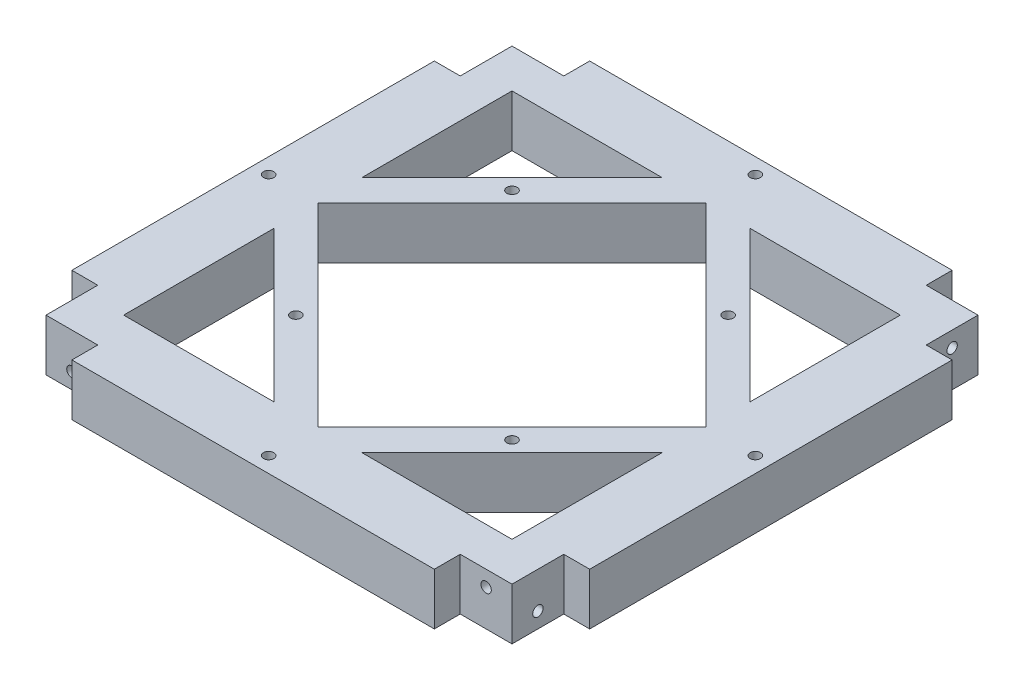
from build123d import *

# Parameters (mm, degrees)
SKETCH1_W           = 100
SKETCH1_H           = 100
BOSS_EXTRUDE1_DEPTH = 10
CUT_EXTRUDE1_DEPTH  = 72.414284285
SKETCH3_W           = 75
SKETCH3_H           = 75
CUT_EXTRUDE2_DEPTH  = 10
BOSS_EXTRUDE2_DEPTH = 10
SKETCH10_R          = 1
CUT_EXTRUDE7_DEPTH  = 72.414284285
SKETCH11_R          = 1
CUT_EXTRUDE8_DEPTH  = 72.414284285
SKETCH12_R          = 1
CUT_EXTRUDE9_DEPTH  = 72.414284285
SKETCH9_R           = 1
CUT_EXTRUDE11_DEPTH = 10
SKETCH13_R          = 1
CUT_EXTRUDE12_DEPTH = 10
SKETCH14_R          = 1
CUT_EXTRUDE13_DEPTH = 10
SKETCH15_R          = 1
CUT_EXTRUDE14_DEPTH = 10
SKETCH16_R          = 1
CUT_EXTRUDE15_DEPTH = 10
SKETCH17_R          = 1
CUT_EXTRUDE16_DEPTH = 10
SKETCH18_R          = 1
CUT_EXTRUDE17_DEPTH = 10
SKETCH19_R          = 1
CUT_EXTRUDE18_DEPTH = 10


with BuildPart() as part:
    # Sketch1 → Boss-Extrude1 (new body)
    with BuildSketch(Plane(origin=(0, 0, 0), x_dir=(1, 0, 0), z_dir=(0, 1, 0))):
        Rectangle(SKETCH1_W, SKETCH1_H)
    extrude(amount=BOSS_EXTRUDE1_DEPTH)

    # Sketch2 → Cut-Extrude1 (cut, through all)
    with BuildSketch(Plane(origin=(0, 10, 0), x_dir=(1, 0, 0), z_dir=(0, 1, 0))):
        Polygon((35, 50), (35, 45), (45, 45), (45, 35), (50, 35), (50, 50), align=None)
        Polygon((-45, 35), (-50, 35), (-50, 50), (-35, 50), (-35, 45), (-45, 45), align=None)
        Polygon((-45, -35), (-50, -35), (-50, -50), (-35, -50), (-35, -45), (-45, -45), align=None)
        Polygon((35, -50), (35, -45), (45, -45), (45, -35), (50, -35), (50, -50), align=None)
    extrude(amount=-CUT_EXTRUDE1_DEPTH, mode=Mode.SUBTRACT)

    # Sketch3 → Cut-Extrude2 (cut)
    with BuildSketch(Plane(origin=(0, 10, 0), x_dir=(1, 0, 0), z_dir=(0, 1, 0))):
        Rectangle(SKETCH3_W, SKETCH3_H)
    extrude(amount=-CUT_EXTRUDE2_DEPTH, mode=Mode.SUBTRACT)

    # Sketch4 → Boss-Extrude2 (add)
    with BuildSketch(Plane(origin=(0, 10, 0), x_dir=(1, 0, 0), z_dir=(0, 1, 0))):
        Polygon((45.985281374, 0), (0, 45.985281374), (-45.985281374, 0), (0, -45.985281374), align=None)
        Polygon((0, 37.5), (-37.5, 0), (0, -37.5), (37.5, 0), align=None, mode=Mode.SUBTRACT)
    extrude(amount=-BOSS_EXTRUDE2_DEPTH)

    # Sketch10 → Cut-Extrude7 (cut, through all)
    with BuildSketch(Plane(origin=(0, 10, 0), x_dir=(1, 0, 0), z_dir=(0, 1, 0))):
        with Locations(Location((0, 47, 0), (0, 0, 270))):
            Circle(SKETCH10_R)
        with Locations(Location((0, -47, 0), (0, 0, 90))):
            Circle(SKETCH10_R)
    extrude(amount=-CUT_EXTRUDE7_DEPTH, mode=Mode.SUBTRACT)

    # Sketch11 → Cut-Extrude8 (cut, through all)
    with BuildSketch(Plane(origin=(0, 10, 0), x_dir=(1, 0, 0), z_dir=(0, 1, 0))):
        with Locations(Location((-47, 0, 0), (0, 0, 270))):
            Circle(SKETCH11_R)
        with Locations(Location((47, 0, 0), (0, 0, 90))):
            Circle(SKETCH11_R)
    extrude(amount=-CUT_EXTRUDE8_DEPTH, mode=Mode.SUBTRACT)

    # Sketch12 → Cut-Extrude9 (cut, through all)
    with BuildSketch(Plane(origin=(0, 10, 0), x_dir=(1, 0, 0), z_dir=(0, 1, 0))):
        with Locations(Location((-20.871320344, 20.871320344, 0), (0, 0, 270))):
            Circle(SKETCH12_R)
        with Locations(Location((20.871320344, 20.871320344, 0), (0, 0, 90))):
            Circle(SKETCH12_R)
        with Locations(Location((20.871320344, -20.871320344, 0), (0, 0, 270))):
            Circle(SKETCH12_R)
        with Locations(Location((-20.871320344, -20.871320344, 0), (0, 0, 90))):
            Circle(SKETCH12_R)
    extrude(amount=-CUT_EXTRUDE9_DEPTH, mode=Mode.SUBTRACT)

    # Sketch9 → Cut-Extrude11 (cut)
    with BuildSketch(Plane.ZY.offset(45)):
        with Locations((-40, 3)):
            Circle(SKETCH9_R)
    extrude(amount=-CUT_EXTRUDE11_DEPTH, mode=Mode.SUBTRACT)

    # Sketch13 → Cut-Extrude12 (cut)
    with BuildSketch(Plane(origin=(0, 0, -45), x_dir=(-1, 0, 0), z_dir=(0, 0, -1))):
        with Locations((40, 7)):
            Circle(SKETCH13_R)
    extrude(amount=-CUT_EXTRUDE12_DEPTH, mode=Mode.SUBTRACT)

    # Sketch14 → Cut-Extrude13 (cut)
    with BuildSketch(Plane.ZY.offset(45)):
        with Locations((40, 7)):
            Circle(SKETCH14_R)
    extrude(amount=-CUT_EXTRUDE13_DEPTH, mode=Mode.SUBTRACT)

    # Sketch15 → Cut-Extrude14 (cut)
    with BuildSketch(Plane.XY.offset(45)):
        with Locations((-40, 3)):
            Circle(SKETCH15_R)
    extrude(amount=-CUT_EXTRUDE14_DEPTH, mode=Mode.SUBTRACT)

    # Sketch16 → Cut-Extrude15 (cut)
    with BuildSketch(Plane.XY.offset(45)):
        with Locations((40, 7)):
            Circle(SKETCH16_R)
    extrude(amount=-CUT_EXTRUDE15_DEPTH, mode=Mode.SUBTRACT)

    # Sketch17 → Cut-Extrude16 (cut)
    with BuildSketch(Plane(origin=(45, 0, 0), x_dir=(0, 0, -1), z_dir=(1, 0, 0))):
        with Locations((-40, 3)):
            Circle(SKETCH17_R)
    extrude(amount=-CUT_EXTRUDE16_DEPTH, mode=Mode.SUBTRACT)

    # Sketch18 → Cut-Extrude17 (cut)
    with BuildSketch(Plane(origin=(45, 0, 0), x_dir=(0, 0, -1), z_dir=(1, 0, 0))):
        with Locations((40, 7)):
            Circle(SKETCH18_R)
    extrude(amount=-CUT_EXTRUDE17_DEPTH, mode=Mode.SUBTRACT)

    # Sketch19 → Cut-Extrude18 (cut)
    with BuildSketch(Plane(origin=(0, 0, -45), x_dir=(-1, 0, 0), z_dir=(0, 0, -1))):
        with Locations((-40, 3)):
            Circle(SKETCH19_R)
    extrude(amount=-CUT_EXTRUDE18_DEPTH, mode=Mode.SUBTRACT)


solid = part.part
